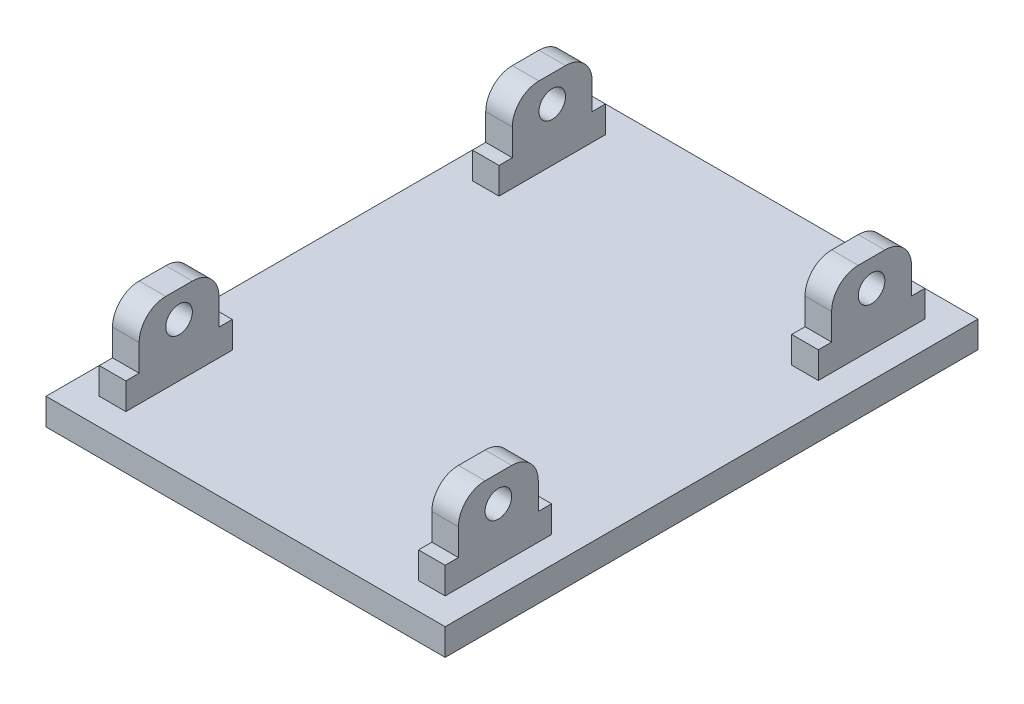
from build123d import *

# Parameters (mm, degrees)
SKETCH1_W           = 150
SKETCH1_H           = 200.24463343
BOSS_EXTRUDE1_DEPTH = 10
SKETCH2_W           = 10
SKETCH2_H           = 40
BOSS_EXTRUDE2_DEPTH = 10
SKETCH4_W           = 30
SKETCH4_H           = 20
BOSS_EXTRUDE3_DEPTH = 10
FILLET1_R           = 10
SKETCH5_R           = 5
CUT_EXTRUDE2_DEPTH  = 10


with BuildPart() as part:
    # Sketch1 → Boss-Extrude1 (new body)
    with BuildSketch(Plane(origin=(0, 0, 0), x_dir=(1, 0, 0), z_dir=(0, 1, 0))):
        Rectangle(SKETCH1_W, SKETCH1_H)
    extrude(amount=BOSS_EXTRUDE1_DEPTH)


with BuildPart() as body_2:
    # Sketch2 → Boss-Extrude2 (new body)
    with BuildSketch(Plane(origin=(0, 10, 0), x_dir=(1, 0, 0), z_dir=(0, 1, 0))):
        with Locations((60, -70.122316715)):
            Rectangle(SKETCH2_W, SKETCH2_H)
    extrude(amount=BOSS_EXTRUDE2_DEPTH)


with BuildPart() as body_3:
    # Sketch4 → Boss-Extrude3 (new body)
    with BuildSketch(Plane(origin=(65, 0, 0), x_dir=(0, 0, -1), z_dir=(1, 0, 0))):
        with Locations((-70.122316715, 30)):
            Rectangle(SKETCH4_W, SKETCH4_H)
    extrude(amount=-BOSS_EXTRUDE3_DEPTH)

    # Fillet1
    fillet1_edges = [body_3.edges().sort_by_distance(p)[0] for p in [
        (60, 40, 55.122316715),
        (60, 40, 85.122316715),
    ]]
    fillet(fillet1_edges, radius=FILLET1_R)

    # Sketch5 → Cut-Extrude2 (cut)
    with BuildSketch(Plane(origin=(65, 0, 0), x_dir=(0, 0, -1), z_dir=(1, 0, 0))):
        with Locations((-70.122316715, 30)):
            Circle(SKETCH5_R)
    extrude(amount=-CUT_EXTRUDE2_DEPTH, mode=Mode.SUBTRACT)

    # Combine1: union body 2
    add(body_2.part)


with BuildPart() as body_3_2:
    # Mirror1: mirrored copy
    add(body_3.part.mirror(Plane.XY))


with BuildPart() as body_4:
    # Mirror3: mirrored copy
    add(body_3_2.part.mirror(Plane(origin=(0, 0, 0), x_dir=(0, 0, 1), z_dir=(1, 0, 0))))


with BuildPart() as body_5:
    # Mirror3 2: mirrored copy
    add(body_3.part.mirror(Plane(origin=(0, 0, 0), x_dir=(0, 0, 1), z_dir=(1, 0, 0))))


solid = Compound([part.part, body_3.part, body_3_2.part, body_4.part, body_5.part])
